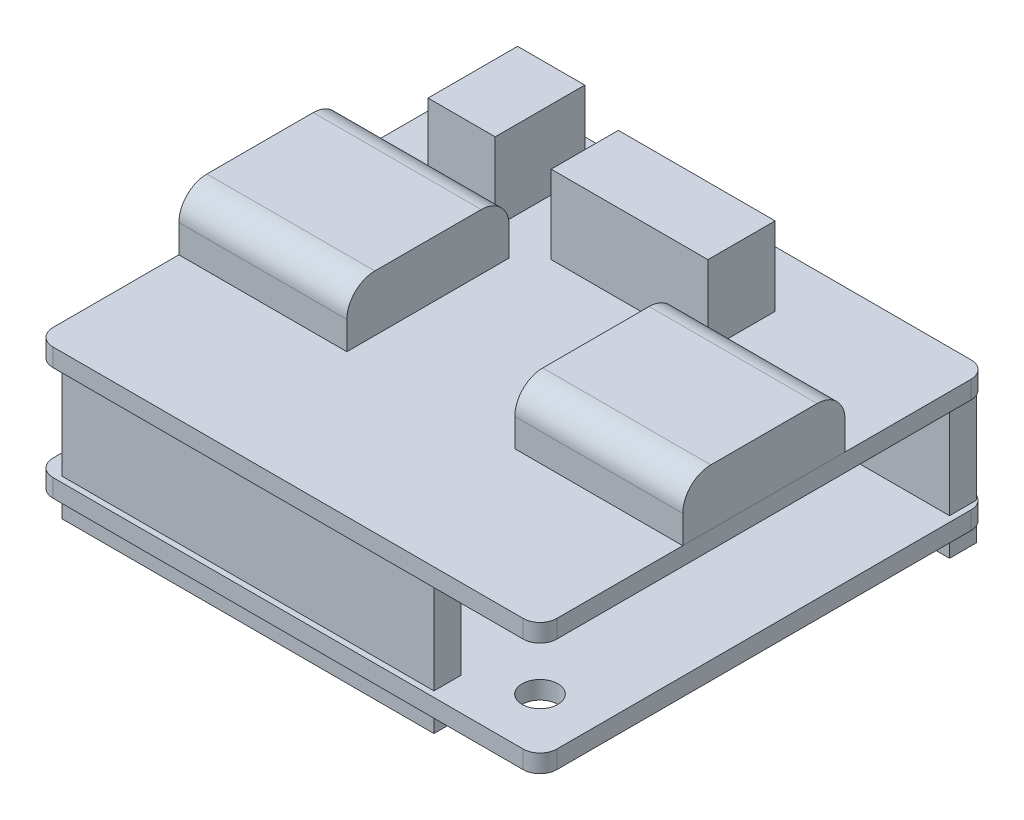
from build123d import *

# Parameters (mm, degrees)
SKETCH1_W                = 45
SKETCH1_H                = 40
BOSS_EXTRUDE1_DEPTH      = 1.6
BOSS_EXTRUDE2_DEPTH      = 8.5
BOSS_EXTRUDE2_DEPTH_BACK = 3.3
SKETCH2_W                = 25.91
SKETCH2_H                = 2.41
SKETCH2_W_2              = 33.2
SKETCH3_W                = 45
SKETCH3_H                = 40
BOSS_EXTRUDE3_DEPTH      = 1.6
SKETCH5_W                = 15
SKETCH5_H                = 14.5
BOSS_EXTRUDE5_DEPTH      = 5
FILLET1_R                = 2.5
SKETCH7_R                = 1.6
CUT_EXTRUDE1_DEPTH       = 1.6
FILLET2_R                = 1.5
FILLET3_R                = 1.5
SKETCH8_W                = 14
SKETCH8_H                = 6
SKETCH8_W_2              = 6
SKETCH8_H_2              = 8
BOSS_EXTRUDE6_DEPTH      = 7
LPATTERN1_COUNT          = 2
LPATTERN1_PITCH          = 30


with BuildPart() as part:
    # Sketch1 → Boss-Extrude1 (new body)
    with BuildSketch(Plane(origin=(0, 0, 0), x_dir=(1, 0, 0), z_dir=(0, 1, 0))):
        Rectangle(SKETCH1_W, SKETCH1_H)
    extrude(amount=BOSS_EXTRUDE1_DEPTH)

    # Sketch2 → Boss-Extrude2 (add, two sides: drawn at the far end of the back side and taken through both)
    with BuildSketch(Plane(origin=(0, 1.6, 0), x_dir=(1, 0, 0), z_dir=(0, 1, 0)).offset(-BOSS_EXTRUDE2_DEPTH_BACK)):
        with Locations((9.035, 18.285)):
            Rectangle(SKETCH2_W, SKETCH2_H)
        with Locations((-4.08, -18.285)):
            Rectangle(SKETCH2_W_2, SKETCH2_H)
    extrude(amount=BOSS_EXTRUDE2_DEPTH + BOSS_EXTRUDE2_DEPTH_BACK)

    # Sketch3 → Boss-Extrude3 (add)
    with BuildSketch(Plane(origin=(0, 10.1, 0), x_dir=(1, 0, 0), z_dir=(0, 1, 0))):
        Rectangle(SKETCH3_W, SKETCH3_H)
    extrude(amount=BOSS_EXTRUDE3_DEPTH)

    # Sketch7 → Cut-Extrude1 (cut)
    with BuildSketch(Plane(origin=(0, 1.6, 0), x_dir=(1, 0, 0), z_dir=(0, 1, 0))):
        with Locations(Location((17.5, -15, 0), (0, 0, 270))):
            Circle(SKETCH7_R)
        with Locations(Location((-17.5, 15, 0), (0, 0, 270))):
            Circle(SKETCH7_R)
    extrude(amount=-CUT_EXTRUDE1_DEPTH, mode=Mode.SUBTRACT)

    # Fillet2
    fillet2_edges = [part.edges().sort_by_distance(p)[0] for p in [
        (22.5, 0.8, 20),
        (-22.5, 0.8, 20),
        (-22.5, 0.8, -20),
        (22.5, 0.8, -20),
    ]]
    fillet(fillet2_edges, radius=FILLET2_R)

    # Fillet3
    fillet3_edges = [part.edges().sort_by_distance(p)[0] for p in [
        (22.5, 10.9, 20),
        (22.5, 10.9, -20),
        (-22.5, 10.9, -20),
        (-22.5, 10.9, 20),
    ]]
    fillet(fillet3_edges, radius=FILLET3_R)

    # Sketch8 → Boss-Extrude6 (add)
    with BuildSketch(Plane(origin=(0, 11.7, 0), x_dir=(1, 0, 0), z_dir=(0, 1, 0))):
        with Locations((1.5, 12)):
            Rectangle(SKETCH8_W, SKETCH8_H)
        with Locations((-13.5, 13)):
            Rectangle(SKETCH8_W_2, SKETCH8_H_2)
    extrude(amount=BOSS_EXTRUDE6_DEPTH)


with BuildPart() as body_2:
    # Sketch5 → Boss-Extrude5 (new body)
    with BuildSketch(Plane(origin=(0, 11.7, 0), x_dir=(1, 0, 0), z_dir=(0, 1, 0))):
        with Locations((-15, 0)):
            Rectangle(SKETCH5_W, SKETCH5_H)
    extrude(amount=BOSS_EXTRUDE5_DEPTH)

    # Fillet1
    fillet1_edges = [body_2.edges().sort_by_distance(p)[0] for p in [
        (-15, 16.7, -7.25),
        (-15, 16.7, 7.25),
    ]]
    fillet(fillet1_edges, radius=FILLET1_R)


with BuildPart() as lpattern1_1:
    # LPattern1: pattern copy
    add(body_2.part.moved(Location(Vector(1, 0, 0) * (1 * LPATTERN1_PITCH))))


solid = Compound([part.part, body_2.part, lpattern1_1.part])
